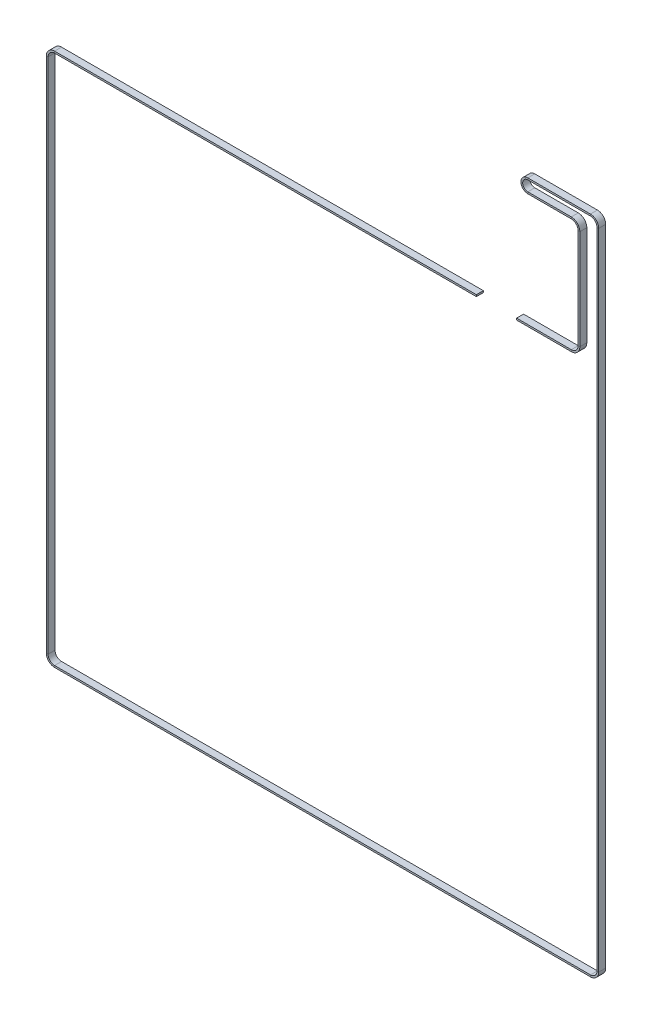
from build123d import *

# Parameters (mm, degrees)
SKETCH4_W = 6
SKETCH4_H = 1.5


with BuildPart() as part:
    # Sweep1: sweep along a path in Sketch1
    with BuildLine(Plane.XY.offset(2.2)) as sweep1_path:
        Line((332.962225959, -251.657000045), (-30.687774041, -251.657000045))
        ThreePointArc((-30.687774041, -251.657000045), (-35.195579771, -253.524194315), (-37.062774041, -258.032000045))
        Line((-37.062774041, -258.032000045), (-37.062774041, -703.985411885))
        ThreePointArc((-37.062774041, -703.985411885), (-35.195579771, -708.493217615), (-30.687774041, -710.360411885))
        Line((-30.687774041, -710.360411885), (431.312225959, -710.360411885))
        ThreePointArc((431.312225959, -710.360411885), (435.820031689, -708.493217615), (437.687225959, -703.985411885))
        Line((437.687225959, -703.985411885), (437.687225959, -148.660411885))
        ThreePointArc((437.687225959, -148.660411885), (435.820031689, -144.152606155), (431.312225959, -142.285411885))
        Line((431.312225959, -142.285411885), (377.312225959, -142.285411885))
        ThreePointArc((377.312225959, -142.285411885), (372.112225959, -147.485411885), (377.312225959, -152.685411885))
        Line((377.312225959, -152.685411885), (414.812225959, -152.685411885))
        ThreePointArc((414.812225959, -152.685411885), (419.479130714, -154.618507129), (421.412225959, -159.285411885))
        Line((421.412225959, -159.285411885), (421.412225959, -245.207000045))
        ThreePointArc((421.412225959, -245.207000045), (419.479130714, -249.873904801), (414.812225959, -251.807000045))
        Line((414.812225959, -251.807000045), (367.662225959, -251.807000045))
    # Sketch4 → Sweep1 (sweep)
    with BuildSketch(Plane(origin=(332.962225959, -251.657000045, 2.2), x_dir=(0, 0, -1), z_dir=(1, 0, 0))):
        Rectangle(SKETCH4_W, SKETCH4_H)
    sweep(path=sweep1_path.line)


solid = part.part
